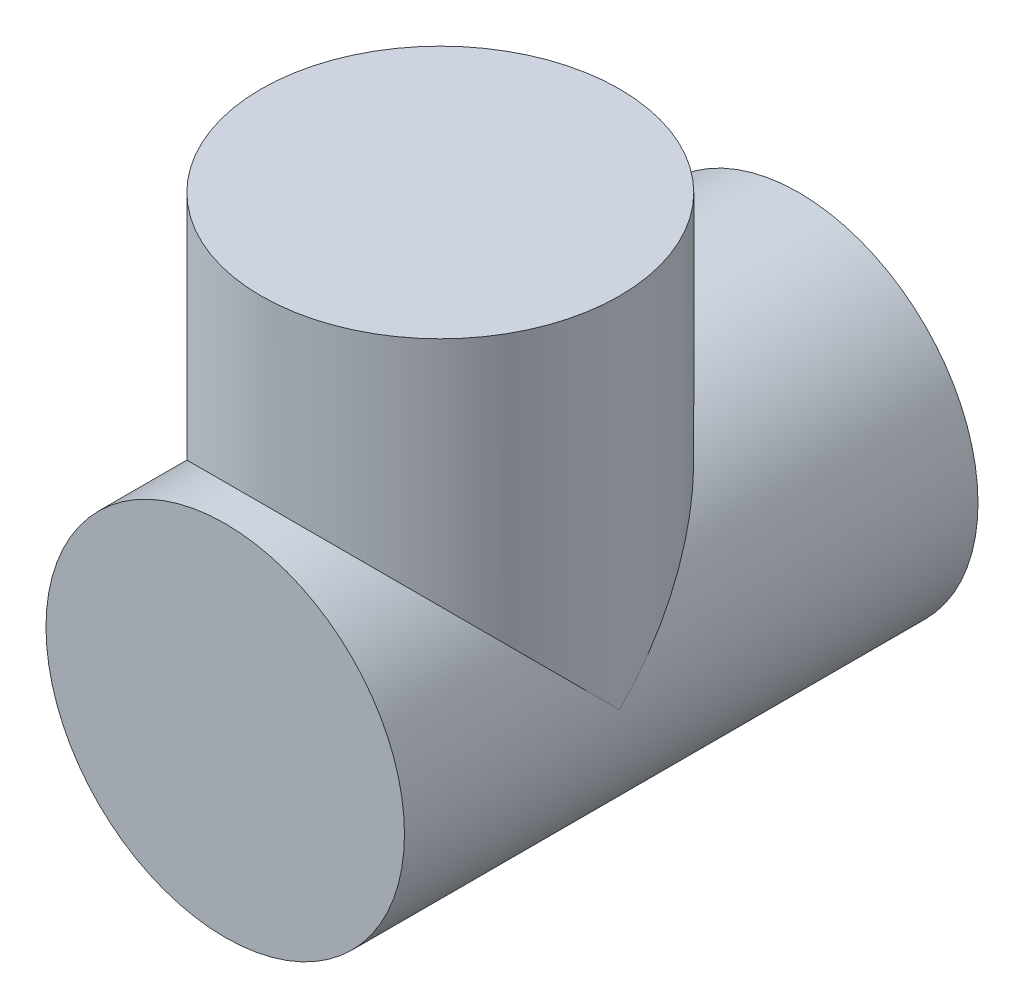
from build123d import *

# Parameters (mm, degrees)
SKETCH_1_R      = 250
EXTRUDE_1_DEPTH = 800
SKETCH_2_R      = 250
EXTRUDE_2_DEPTH = 500


with BuildPart() as part:
    # 草图1 → 凸台-拉伸1 (new body)
    with BuildSketch(Plane.XY):
        Circle(SKETCH_1_R)
    extrude(amount=EXTRUDE_1_DEPTH)

    # 草图2 → 凸台-拉伸2 (add)
    with BuildSketch(Plane(origin=(0, 0, 0), x_dir=(1, 0, 0), z_dir=(0, 1, 0))):
        with Locations((0, -500)):
            Circle(SKETCH_2_R)
    extrude(amount=EXTRUDE_2_DEPTH)


solid = part.part
